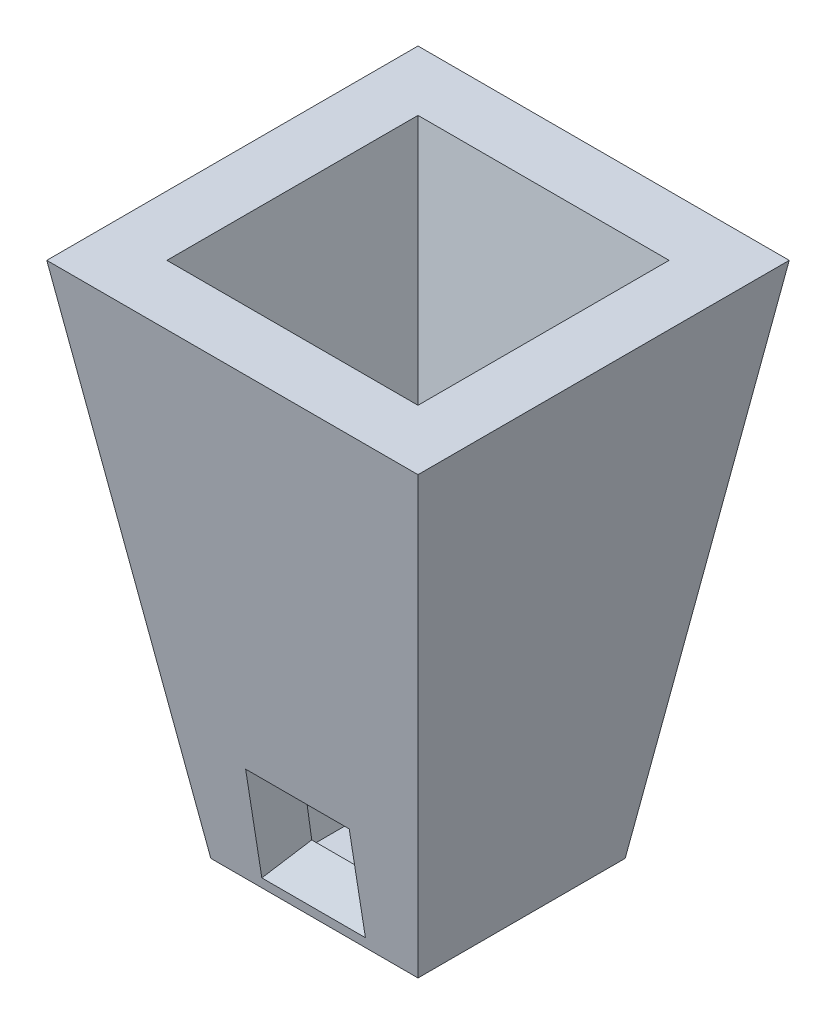
from build123d import *

# Parameters (mm, degrees)
SKETCH1_W           = 50.8
SKETCH1_H           = 50.8
BOSS_EXTRUDE1_DEPTH = 127
BOSS_EXTRUDE1_DRAFT = -9
SKETCH2_W           = 61.565647843
SKETCH2_H           = 61.565647842
CUT_EXTRUDE1_DEPTH  = 124.46
CUT_EXTRUDE1_DRAFT  = -8
CUT_EXTRUDE2_REACH  = 165.697
SKETCH3_W           = 25.4
SKETCH3_H           = 25.4
CUT_EXTRUDE3_REACH  = 161.627
SKETCH4_W           = 25.4
SKETCH4_H           = 25.4


with BuildPart() as part:
    # Sketch1 → Boss-Extrude1 (with draft: the straight prism first)
    with BuildSketch(Plane(origin=(0, 0, 0), x_dir=(1, 0, 0), z_dir=(0, 1, 0))):
        with Locations((-18.114225515, -17.77595618)):
            Rectangle(SKETCH1_W, SKETCH1_H)
    extrude(amount=BOSS_EXTRUDE1_DEPTH)
    # Boss-Extrude1: the draft: its side faces are tilted about the plane it starts from
    boss_extrude1_sides = [part.faces().sort_by_distance(p)[0] for p in [
        (-43.514225515, 63.5, 17.77595618),
        (-18.114225515, 63.5, 43.17595618),
        (7.285774485, 63.5, 17.77595618),
        (-18.114225515, 63.5, -7.62404382),
    ]]
    draft(boss_extrude1_sides, Plane(origin=(0, 0, 0), x_dir=(1, 0, 0), z_dir=(0, 1, 0)), BOSS_EXTRUDE1_DRAFT)


with BuildPart() as cut_extrude1_tool:
    # Sketch2 → Cut-Extrude1 (with draft: the straight prism first)
    with BuildSketch(Plane(origin=(0, 127, 0), x_dir=(1, 0, 0), z_dir=(0, 1, 0))):
        with Locations((-18.114225515, -17.77595618)):
            Rectangle(SKETCH2_W, SKETCH2_H)
    extrude(amount=-CUT_EXTRUDE1_DEPTH)
    # Cut-Extrude1: the draft: its side faces are tilted about the plane it starts from
    cut_extrude1_sides = [cut_extrude1_tool.faces().sort_by_distance(p)[0] for p in [
        (-48.897049437, 64.77, 17.77595618),
        (-18.114225515, 64.77, 48.558780101),
        (12.668598406, 64.77, 17.77595618),
        (-18.114225515, 64.77, -13.006867741),
    ]]
    draft(cut_extrude1_sides, Plane(origin=(0, 127, 0), x_dir=(1, 0, 0), z_dir=(0, 1, 0)), CUT_EXTRUDE1_DRAFT)


with BuildPart() as part_1:
    add(part.part)

    # Cut-Extrude1: cut by cut_extrude1_tool
    add(cut_extrude1_tool.part, mode=Mode.SUBTRACT)

    # Cut-Extrude2: up to this plane
    cut_extrude2_end = Plane(origin=(-48.897049437, 127, 48.558780101), z_dir=(0, -0.1391731009600655, 0.9902680687415704))
    # Sketch3 → Cut-Extrude2 (cut, up to the surface)
    with BuildSketch(Plane(origin=(0, -6.671052104, 42.119365326), x_dir=(1, 0, 0), z_dir=(0, -0.15643446504023092, 0.9876883405951379)), mode=Mode.PRIVATE) as cut_extrude2_sk1:
        with Locations((-17.909049437, 21.994207608)):
            Rectangle(SKETCH3_W, SKETCH3_H)
    cut_extrude2_tool1 = split(extrude(cut_extrude2_sk1.sketch, amount=-CUT_EXTRUDE2_REACH, mode=Mode.PRIVATE), bisect_by=cut_extrude2_end, keep=Keep.BOTH, mode=Mode.PRIVATE)
    add(cut_extrude2_tool1.solids().sort_by_distance((-17.909049, 15.05237, 45.560017))[0], mode=Mode.SUBTRACT)

    # Cut-Extrude3: up to this plane
    cut_extrude3_end = Plane(origin=(-48.897049437, 127, -13.006867741), z_dir=(0, -0.1391731009600655, -0.9902680687415704))
    # Sketch4 → Cut-Extrude3 (cut, up to the surface)
    with BuildSketch(Plane(origin=(0, -1.177979553, -7.437470188), x_dir=(-1, 0, 0), z_dir=(0, -0.15643446504023092, -0.9876883405951379)), mode=Mode.PRIVATE) as cut_extrude3_sk1:
        with Locations((18.319401594, 16.432663216)):
            Rectangle(SKETCH4_W, SKETCH4_H)
    cut_extrude3_tool1 = split(extrude(cut_extrude3_sk1.sketch, amount=-CUT_EXTRUDE3_REACH, mode=Mode.PRIVATE), bisect_by=cut_extrude3_end, keep=Keep.BOTH, mode=Mode.PRIVATE)
    add(cut_extrude3_tool1.solids().sort_by_distance((-18.319402, 15.05237, -10.008105))[0], mode=Mode.SUBTRACT)


solid = part_1.part
